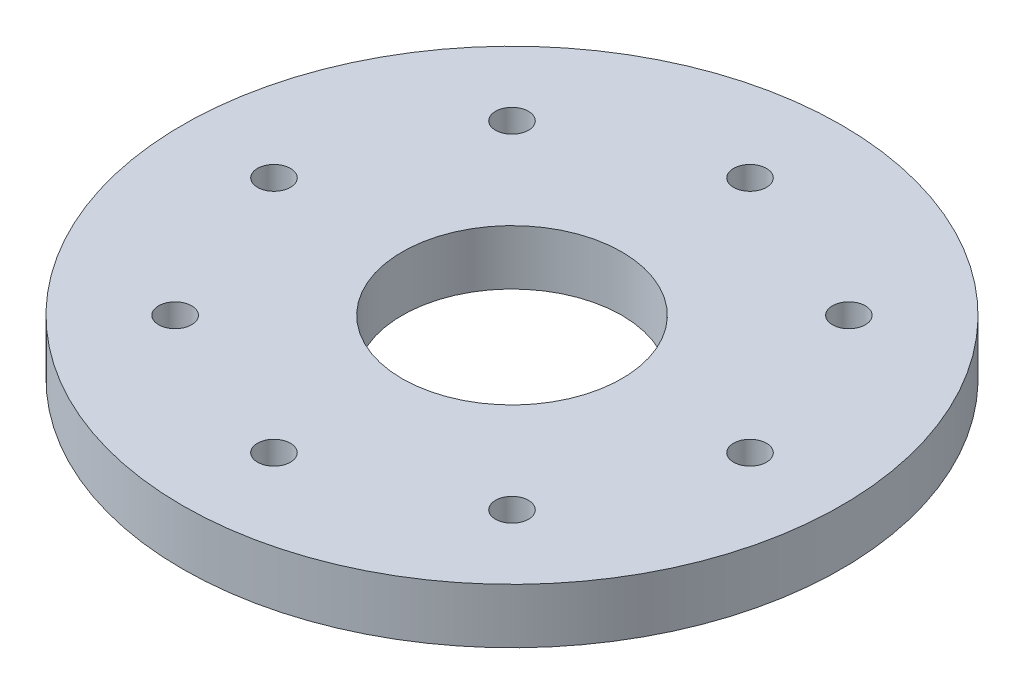
from build123d import *

# Parameters (mm, degrees)
SKETCH_1_R      = 180
SKETCH_1_R_2    = 60
SKETCH_1_R_3    = 9
EXTRUDE_1_DEPTH = 30


with BuildPart() as part:
    # 草图1 → 凸台-拉伸1 (new body)
    with BuildSketch(Plane(origin=(0, 0, 0), x_dir=(1, 0, 0), z_dir=(0, 1, 0))):
        with Locations(Location((0, 0, 0), (0, 0, 270))):
            Circle(SKETCH_1_R)
        with Locations(Location((0, 0, 0), (0, 0, 270))):
            Circle(SKETCH_1_R_2, mode=Mode.SUBTRACT)
        with Locations(Location((130, 0, 0), (0, 0, 270))):
            Circle(SKETCH_1_R_3, mode=Mode.SUBTRACT)
        with Locations(Location((-130, 0, 0), (0, 0, 270))):
            Circle(SKETCH_1_R_3, mode=Mode.SUBTRACT)
        with Locations(Location((0, 130, 0), (0, 0, 270))):
            Circle(SKETCH_1_R_3, mode=Mode.SUBTRACT)
        with Locations(Location((0, -130, 0), (0, 0, 270))):
            Circle(SKETCH_1_R_3, mode=Mode.SUBTRACT)
        with Locations(Location((92, 92, 0), (0, 0, 270))):
            Circle(SKETCH_1_R_3, mode=Mode.SUBTRACT)
        with Locations(Location((-92, 92, 0), (0, 0, 270))):
            Circle(SKETCH_1_R_3, mode=Mode.SUBTRACT)
        with Locations(Location((92, -92, 0), (0, 0, 270))):
            Circle(SKETCH_1_R_3, mode=Mode.SUBTRACT)
        with Locations(Location((-92, -92, 0), (0, 0, 270))):
            Circle(SKETCH_1_R_3, mode=Mode.SUBTRACT)
    extrude(amount=EXTRUDE_1_DEPTH)


solid = part.part
